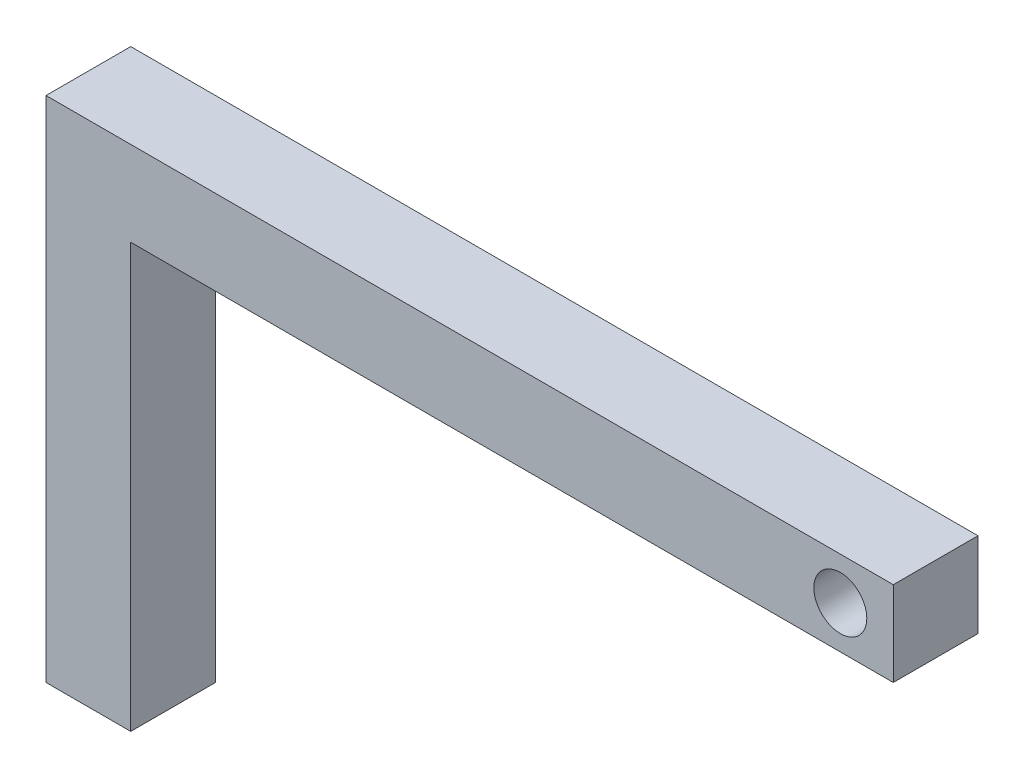
from build123d import *

# Parameters (mm, degrees)
BOSS_EXTRUDE1_DEPTH = 80
SKETCH2_R           = 25
CUT_EXTRUDE1_DEPTH  = 161
SKETCH3_R           = 15
CUT_EXTRUDE2_DEPTH  = 10


with BuildPart() as part:
    # Sketch1 → Boss-Extrude1 (new body)
    with BuildSketch(Plane.XY):
        Polygon((0, 0), (0, 480), (800, 480), (800, 400), (80, 400), (80, 0), align=None)
    extrude(amount=BOSS_EXTRUDE1_DEPTH)

    # Sketch2 → Cut-Extrude1 (cut)
    with BuildSketch(Plane.XY.offset(80)):
        with Locations((750, 440)):
            Circle(SKETCH2_R)
    extrude(amount=-CUT_EXTRUDE1_DEPTH, mode=Mode.SUBTRACT)

    # Sketch3 → Cut-Extrude2 (cut)
    with BuildSketch(Plane.XZ):
        with Locations(Location((40, 40, 0), (0, 0, 270))):
            Circle(SKETCH3_R)
    extrude(amount=-CUT_EXTRUDE2_DEPTH, mode=Mode.SUBTRACT)


solid = part.part
